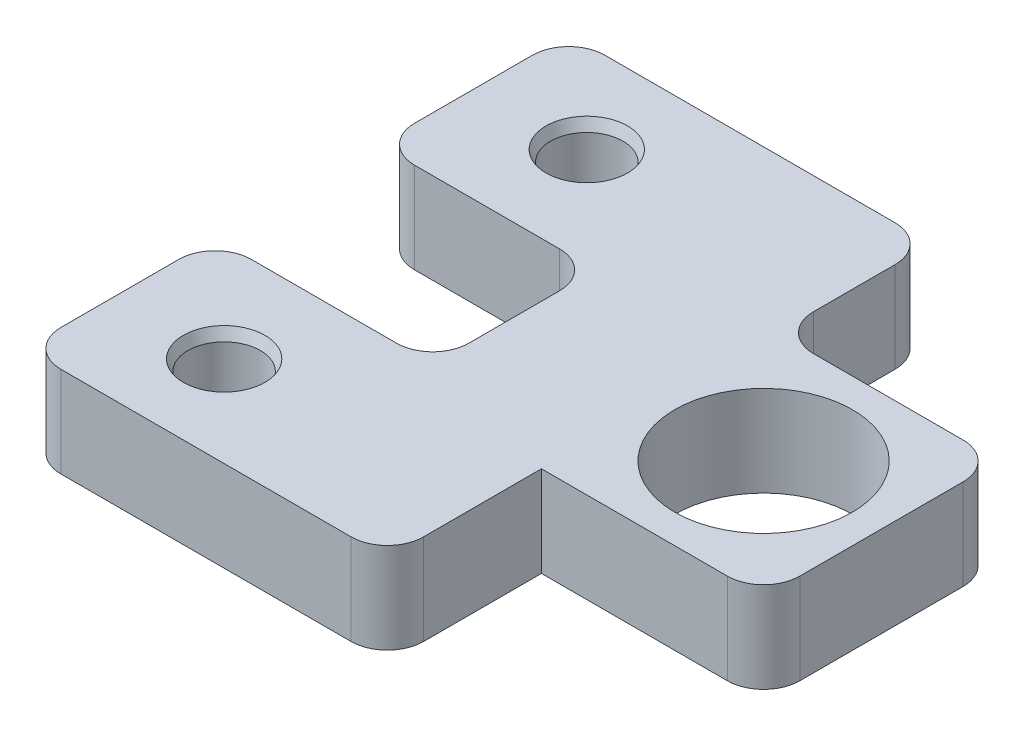
from build123d import *

# Parameters (mm, degrees)
SKETCH1_R                         = 4.9
BOSS_EXTRUDE1_DEPTH               = 5
FILLET1_R                         = 2
F_4_0_4_DIAMETER_HOLE1_AT_2_COUNT = 2
F_4_0_4_DIAMETER_HOLE1_AT_2_PITCH = 10
F_4_0_4_DIAMETER_HOLE1_AT_3_COUNT = 2
F_4_0_4_DIAMETER_HOLE1_AT_3_PITCH = 10


with BuildPart() as part:
    # Sketch1 → Boss-Extrude1 (new body)
    with BuildSketch(Plane(origin=(0, 0, 0), x_dir=(1, 0, 0), z_dir=(0, 1, 0))):
        Polygon((-10, 15), (-10, 4.5), (2, 4.5), (2, -4.5), (-10, -4.5), (-10, -15), (10, -15), (10, -6.5), (22.25, -6.5), (22.25, 6.5), (10, 6.5), (10, 15), align=None)
        with Locations(Location((15.75, 0, 0), (0, 0, 270))):
            Circle(SKETCH1_R, mode=Mode.SUBTRACT)
    extrude(amount=BOSS_EXTRUDE1_DEPTH)

    # Fillet1
    fillet1_edges = [part.edges().sort_by_distance(p)[0] for p in [
        (10, 2.5, 15),
        (-10, 2.5, 15),
        (-10, 2.5, 4.5),
        (2, 2.5, 4.5),
        (2, 2.5, -4.5),
        (-10, 2.5, -4.5),
        (-10, 2.5, -15),
        (10, 2.5, -15),
        (10, 2.5, -6.5),
        (22.25, 2.5, -6.5),
        (22.25, 2.5, 6.5),
    ]]
    fillet(fillet1_edges, radius=FILLET1_R)

    # Sketch5 → Ø4.0 (4) Diameter Hole1 (revolve, cut)
    with BuildSketch(Plane(origin=(-4, 5, 0), x_dir=(0, 0, 1), z_dir=(1, 0, 0))):
        Polygon((0, 0), (0, 5), (2, 5), (2, 0.603553391), (2.25, 0), align=None)
    f_4_0_4_diameter_hole1 = revolve(axis=Axis((-4, 11.35, 0), (0, -1, 0)), mode=Mode.SUBTRACT)

    # Ø4.0 (4) Diameter Hole1 at 2: Ø4.0 (4) Diameter Hole1 ×2
    with Locations(*[(0, 0, i * F_4_0_4_DIAMETER_HOLE1_AT_2_PITCH) for i in range(1, F_4_0_4_DIAMETER_HOLE1_AT_2_COUNT)]):
        add(f_4_0_4_diameter_hole1, mode=Mode.SUBTRACT)

    # Ø4.0 (4) Diameter Hole1 at 3: Ø4.0 (4) Diameter Hole1 ×2
    with Locations(*[(0, 0, -i * F_4_0_4_DIAMETER_HOLE1_AT_3_PITCH) for i in range(1, F_4_0_4_DIAMETER_HOLE1_AT_3_COUNT)]):
        add(f_4_0_4_diameter_hole1, mode=Mode.SUBTRACT)


solid = part.part
